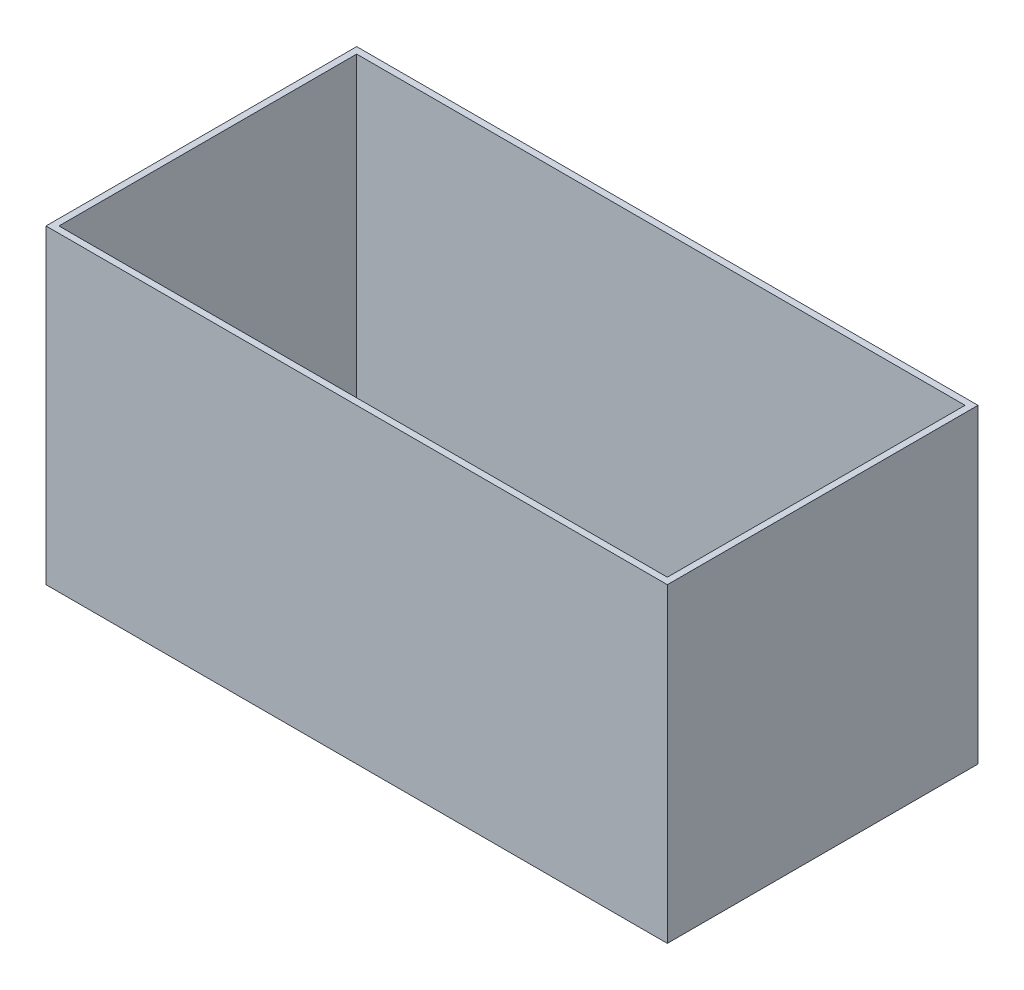
from build123d import *

# Parameters (mm, degrees)
SKETCH1_W           = 609.6
SKETCH1_H           = 304.8
BOSS_EXTRUDE1_DEPTH = 304.8
SKETCH2_W           = 596.9
SKETCH2_H           = 292.1
CUT_EXTRUDE1_DEPTH  = 298.45


with BuildPart() as part:
    # Sketch1 → Boss-Extrude1 (new body)
    with BuildSketch(Plane(origin=(0, 0, 0), x_dir=(1, 0, 0), z_dir=(0, 1, 0))):
        with Locations((304.8, 152.4)):
            Rectangle(SKETCH1_W, SKETCH1_H)
    extrude(amount=BOSS_EXTRUDE1_DEPTH)

    # Sketch2 → Cut-Extrude1 (cut)
    with BuildSketch(Plane(origin=(0, 304.8, 0), x_dir=(1, 0, 0), z_dir=(0, 1, 0))):
        with Locations((304.8, 152.4)):
            Rectangle(SKETCH2_W, SKETCH2_H)
    extrude(amount=-CUT_EXTRUDE1_DEPTH, mode=Mode.SUBTRACT)


solid = part.part
